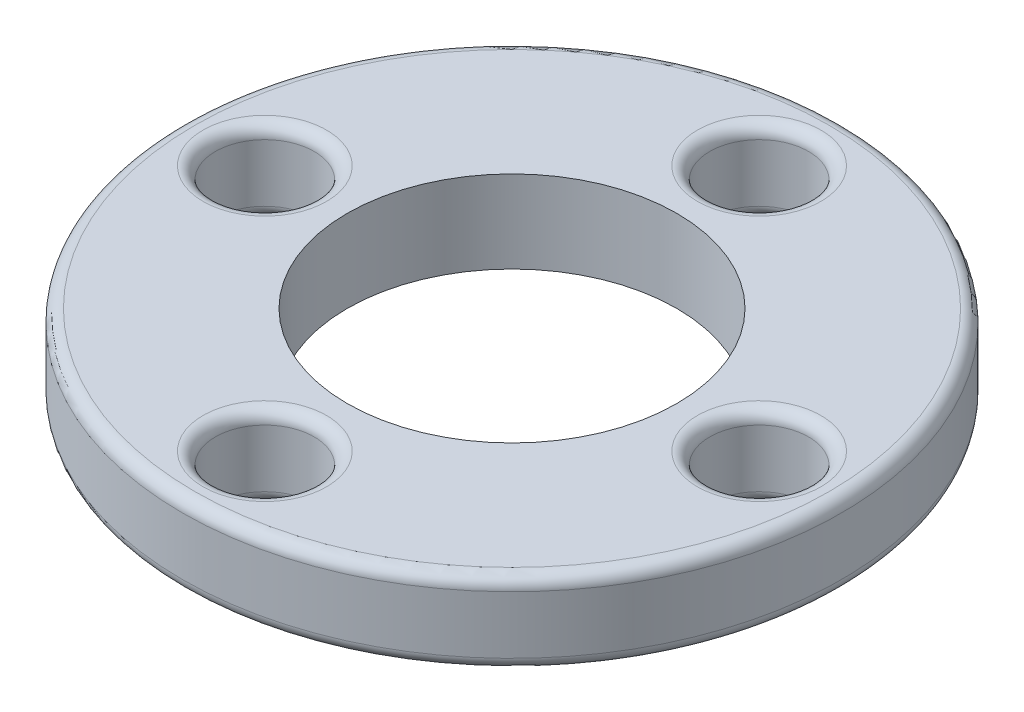
from build123d import *

# Parameters (mm, degrees)
SKETCH_1_R      = 8
SKETCH_1_R_2    = 1.2
SKETCH_1_R_3    = 4
EXTRUDE_1_DEPTH = 2
FILLET_1_R      = 0.3
FILLET_2_R      = 0.3


with BuildPart() as part:
    # 草图1 → 凸台-拉伸1 (new body)
    with BuildSketch(Plane(origin=(0, 0, 0), x_dir=(1, 0, 0), z_dir=(0, 1, 0))):
        with Locations(Location((0, 0, 0), (0, 0, 270))):
            Circle(SKETCH_1_R)
        with Locations(Location((0, 6, 0), (0, 0, 270))):
            Circle(SKETCH_1_R_2, mode=Mode.SUBTRACT)
        with Locations(Location((0, 0, 0), (0, 0, 270))):
            Circle(SKETCH_1_R_3, mode=Mode.SUBTRACT)
        with Locations(Location((6, 0, 0), (0, 0, 270))):
            Circle(SKETCH_1_R_2, mode=Mode.SUBTRACT)
        with Locations(Location((0, -6, 0), (0, 0, 270))):
            Circle(SKETCH_1_R_2, mode=Mode.SUBTRACT)
        with Locations(Location((-6, 0, 0), (0, 0, 270))):
            Circle(SKETCH_1_R_2, mode=Mode.SUBTRACT)
    extrude(amount=EXTRUDE_1_DEPTH)

    # 圆角1
    fillet_1_edges = [part.edges().sort_by_distance(p)[0] for p in [
        (6, 0, -1.2),
        (6, 2, -1.2),
        (0, 0, 4.8),
        (0, 2, 4.8),
        (-6, 0, -1.2),
        (-6, 2, -1.2),
        (0, 0, -7.2),
        (0, 2, -7.2),
    ]]
    fillet(fillet_1_edges, radius=FILLET_1_R)

    # 圆角2
    fillet_2_edges = [part.edges().sort_by_distance(p)[0] for p in [
        (0, 0, -8),
        (0, 2, -8),
    ]]
    fillet(fillet_2_edges, radius=FILLET_2_R)


solid = part.part
